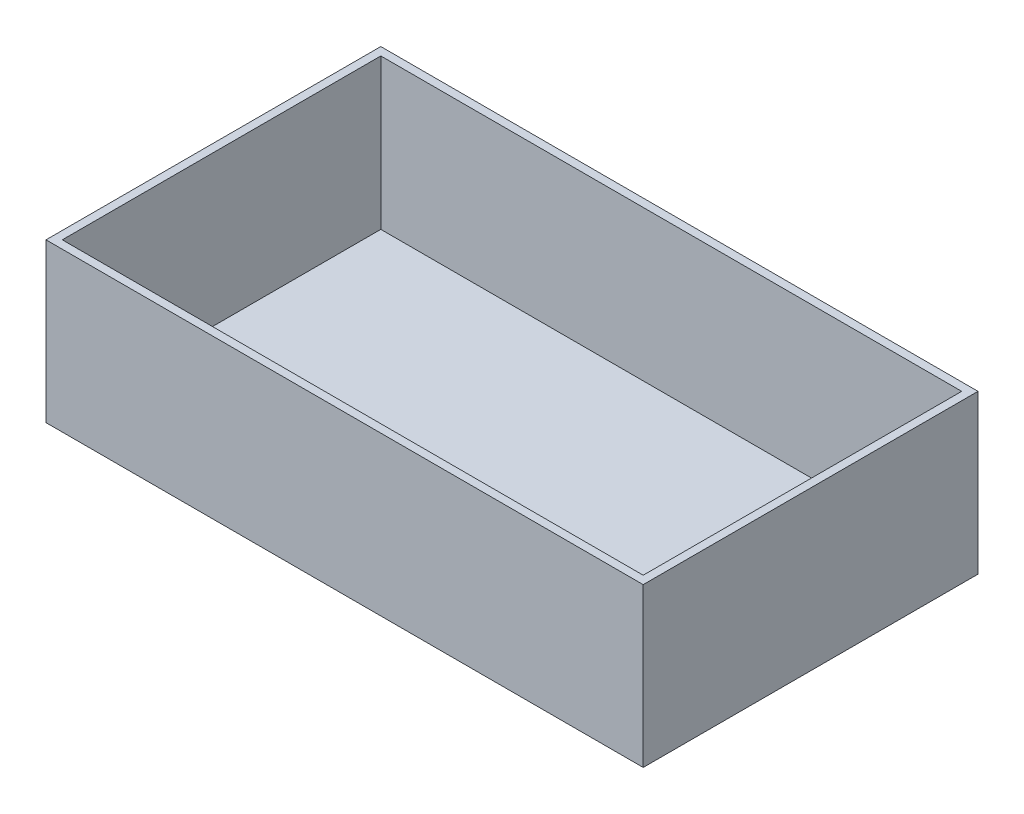
from build123d import *

# Parameters (mm, degrees)
CROQUIS1_W              = 1320
CROQUIS1_H              = 740
SALIENTE_EXTRUIR1_DEPTH = 350
CROQUIS2_W              = 1284
CROQUIS2_H              = 704
CORTAR_EXTRUIR1_DEPTH   = 332


with BuildPart() as part:
    # Croquis1 → Saliente-Extruir1 (new body)
    with BuildSketch(Plane(origin=(0, 0, 0), x_dir=(1, 0, 0), z_dir=(0, 1, 0))):
        Rectangle(CROQUIS1_W, CROQUIS1_H)
    extrude(amount=SALIENTE_EXTRUIR1_DEPTH)

    # Croquis2 → Cortar-Extruir1 (cut)
    with BuildSketch(Plane(origin=(0, 350, 0), x_dir=(1, 0, 0), z_dir=(0, 1, 0))):
        Rectangle(CROQUIS2_W, CROQUIS2_H)
    extrude(amount=-CORTAR_EXTRUIR1_DEPTH, mode=Mode.SUBTRACT)


solid = part.part
